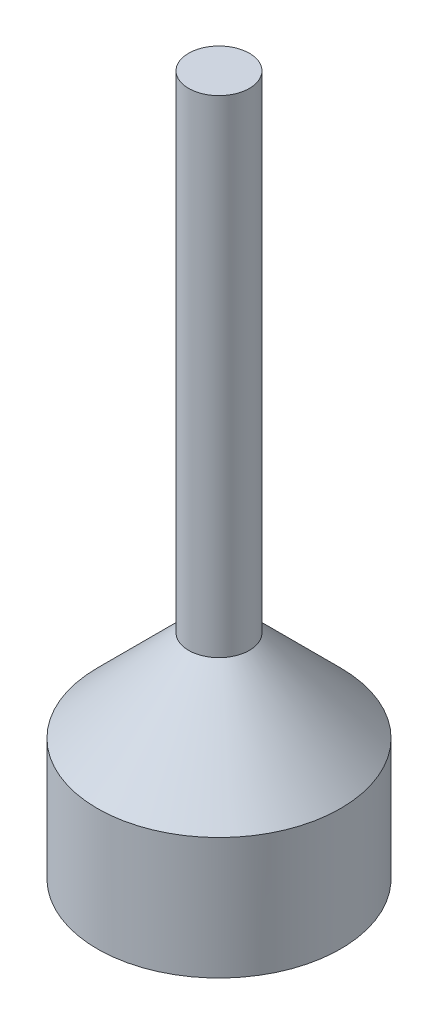
from build123d import *


with BuildPart() as part:
    # 草图1 → 旋转1 (revolve)
    with BuildSketch(Plane.XY):
        Polygon((0, 0), (-20, 0), (-20, 20), (-5, 35), (-5, 115), (0, 115), align=None)
    revolve(axis=Axis((0, 115, 0), (0, -1, 0)))


solid = part.part
